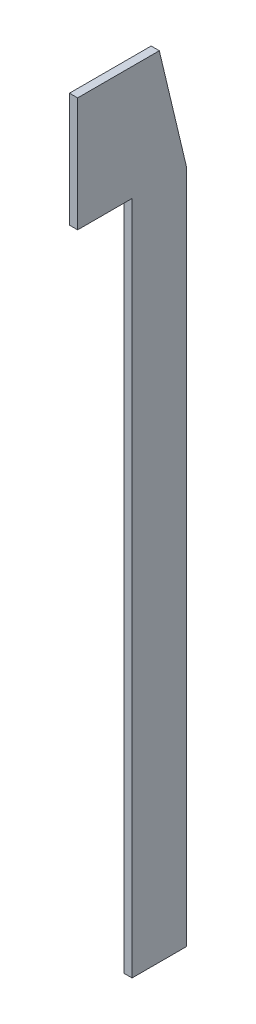
from build123d import *

# Parameters (mm, degrees)
EXTRUDE_1_DEPTH     = 3
CUT_EXTRUDE_1_DEPTH = 3


with BuildPart() as part:
    # 스케치1 → 보스-돌출1 (new body)
    with BuildSketch(Plane(origin=(0, 0, 0), x_dir=(0, 0, -1), z_dir=(1, 0, 0))):
        Polygon((0, 0), (20, 0), (20, 290), (-20, 290), (-20, 248), (0, 248), align=None)
    extrude(amount=EXTRUDE_1_DEPTH)

    # 스케치2 → 컷-돌출1 (cut)
    with BuildSketch(Plane(origin=(3, 0, 0), x_dir=(0, 0, -1), z_dir=(1, 0, 0))):
        Polygon((10, 290), (20, 248), (20, 290), align=None)
    extrude(amount=-CUT_EXTRUDE_1_DEPTH, mode=Mode.SUBTRACT)


solid = part.part
